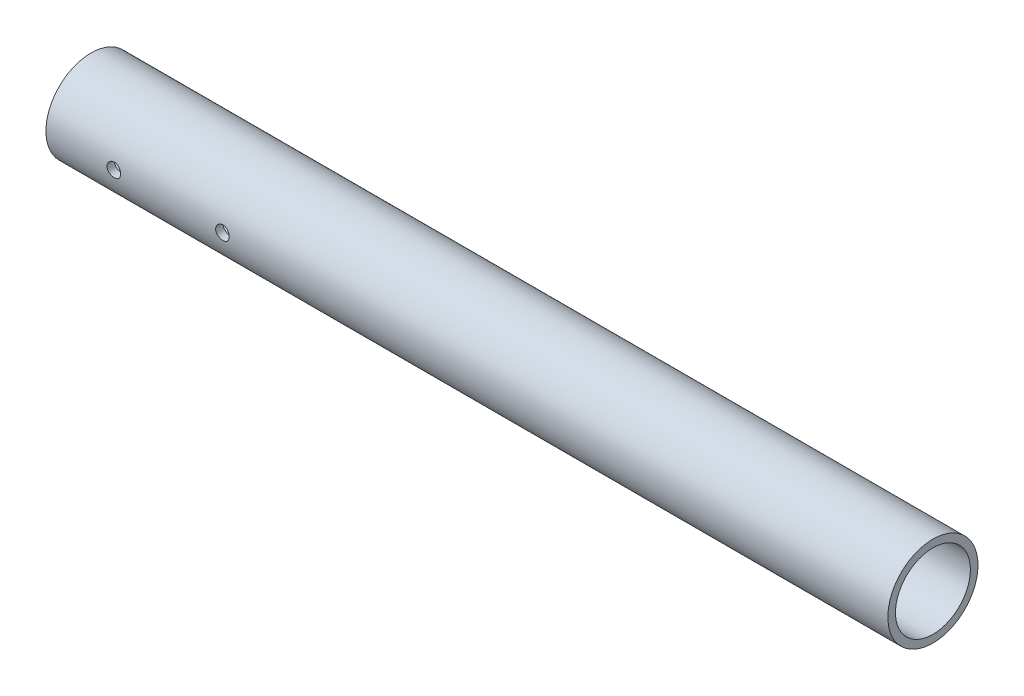
from build123d import *

# Parameters (mm, degrees)
BOSS_EXTRUDE1_DEPTH      = 196.85
BOSS_EXTRUDE1_DEPTH_BACK = 196.85
SKETCH1_R                = 21.082
SKETCH1_R_2              = 17.526
SKETCH2_R                = 3.175
CUT_EXTRUDE1_DEPTH       = 200.095012363


with BuildPart() as part:
    # Sketch1 → Boss-Extrude1 (new, two sides: drawn at the far end of the back side and taken through both)
    with BuildSketch(Plane(origin=(0, 0, 0), x_dir=(0, 0, -1), z_dir=(1, 0, 0)).offset(-BOSS_EXTRUDE1_DEPTH_BACK)):
        Circle(SKETCH1_R)
        Circle(SKETCH1_R_2, mode=Mode.SUBTRACT)
    extrude(amount=BOSS_EXTRUDE1_DEPTH + BOSS_EXTRUDE1_DEPTH_BACK)

    # Sketch2 → Cut-Extrude1 (cut, through all)
    with BuildSketch(Plane.XY):
        with Locations(Location((-114.3, 0, 0), (0, 0, 180))):
            Circle(SKETCH2_R)
        with Locations(Location((-165.1, 0, 0), (0, 0, 180))):
            Circle(SKETCH2_R)
    extrude(amount=CUT_EXTRUDE1_DEPTH, mode=Mode.SUBTRACT)


solid = part.part
